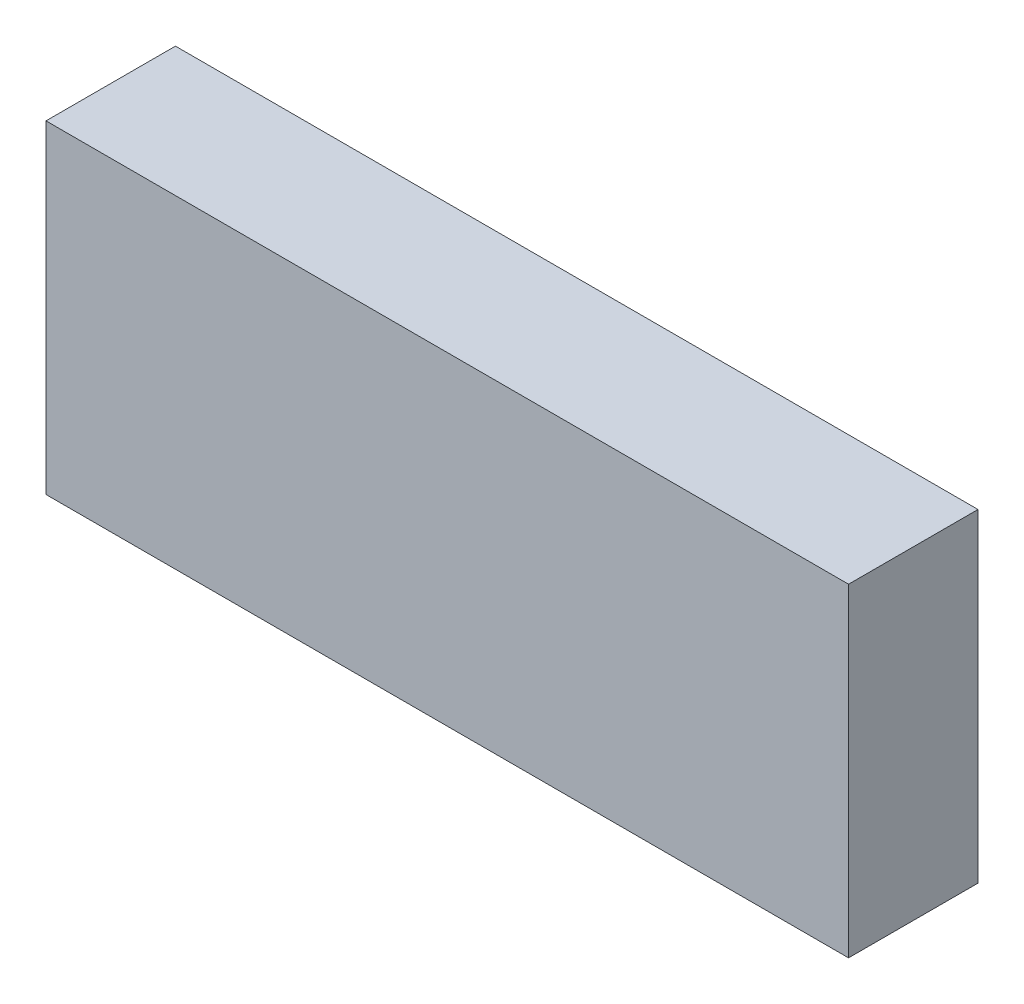
from build123d import *

# Parameters (mm, degrees)
SKICA1_W                = 12.4
SKICA1_H                = 5
P_IDAT_VYSUNUT_M1_DEPTH = 2


with BuildPart() as part:
    # Skica1 → Přidat vysunutím1 (new body)
    with BuildSketch(Plane.XY):
        with Locations((6.2, 2.5)):
            Rectangle(SKICA1_W, SKICA1_H)
    extrude(amount=P_IDAT_VYSUNUT_M1_DEPTH)


solid = part.part
